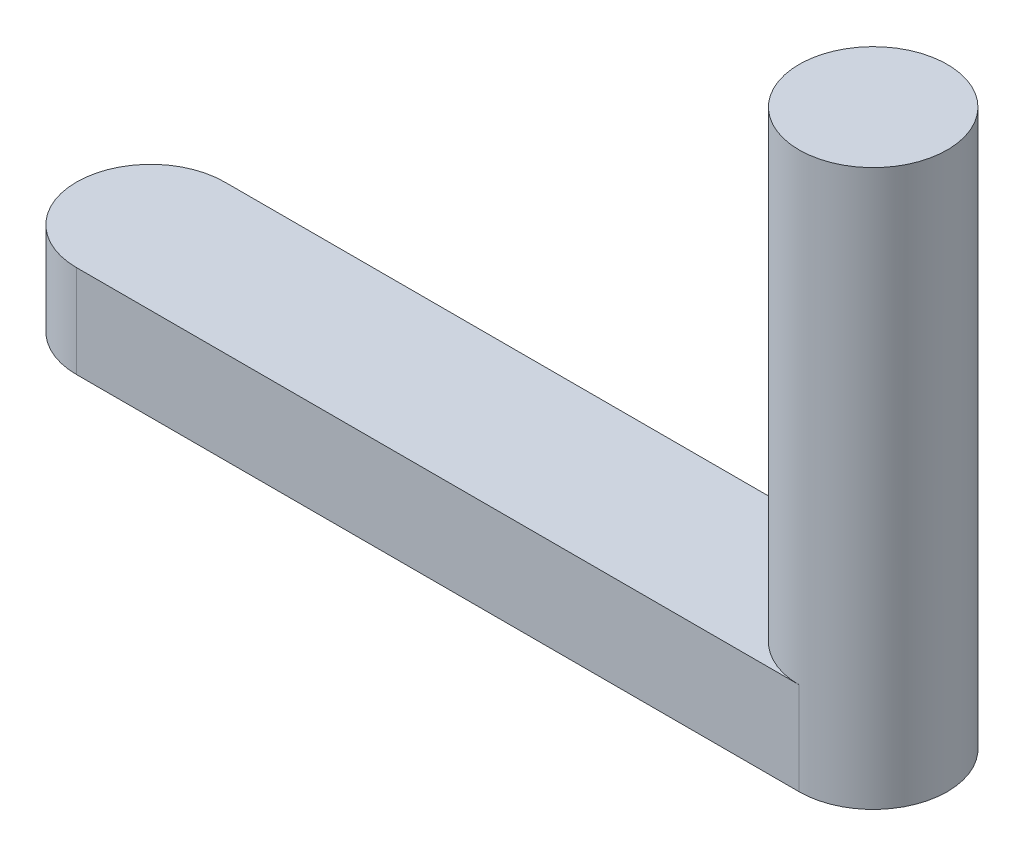
from build123d import *
from build123d.topology import SkipClean

# Parameters (mm, degrees)
BOSS_EXTRUDE1_DEPTH = 5
SKETCH2_R           = 2.525
CUT_EXTRUDE1_DEPTH  = 2
SKETCH3_R           = 4
BOSS_EXTRUDE2_DEPTH = 30


with BuildPart() as part:
    # Sketch1 → Boss-Extrude1 (new body)
    with BuildSketch(Plane(origin=(0, 0, 0), x_dir=(1, 0, 0), z_dir=(0, 1, 0))):
        with BuildLine():
            Line((0, 0), (39, 0))
            ThreePointArc((39, 0), (43.000000182, -3.999999909), (39.000000182, -8))
            Line((39.000000182, -8), (1.82e-07, -8))
            ThreePointArc((1.82e-07, -8), (-4, -4.000000091), (0, 0))
        make_face()
    extrude(amount=BOSS_EXTRUDE1_DEPTH)

    # Sketch2 → Cut-Extrude1 (cut)
    with BuildSketch(Plane(origin=(0, 0, 0), x_dir=(1, 0, 0), z_dir=(0, 1, 0))):
        with Locations(Location((0, -4, 0), (0, 0, 270))):
            Circle(SKETCH2_R)
    extrude(amount=CUT_EXTRUDE1_DEPTH, mode=Mode.SUBTRACT)

    # Sketch3 → Boss-Extrude2 (add)
    with SkipClean():  # the faces are left unmerged after this step: merging them gives an invalid solid
        with BuildSketch(Plane(origin=(0, 0, 0), x_dir=(1, 0, 0), z_dir=(0, 1, 0))):
            with Locations(Location((39.000000182, -4, 0), (0, 0, 270))):
                Circle(SKETCH3_R)
        extrude(amount=BOSS_EXTRUDE2_DEPTH)


solid = part.part
